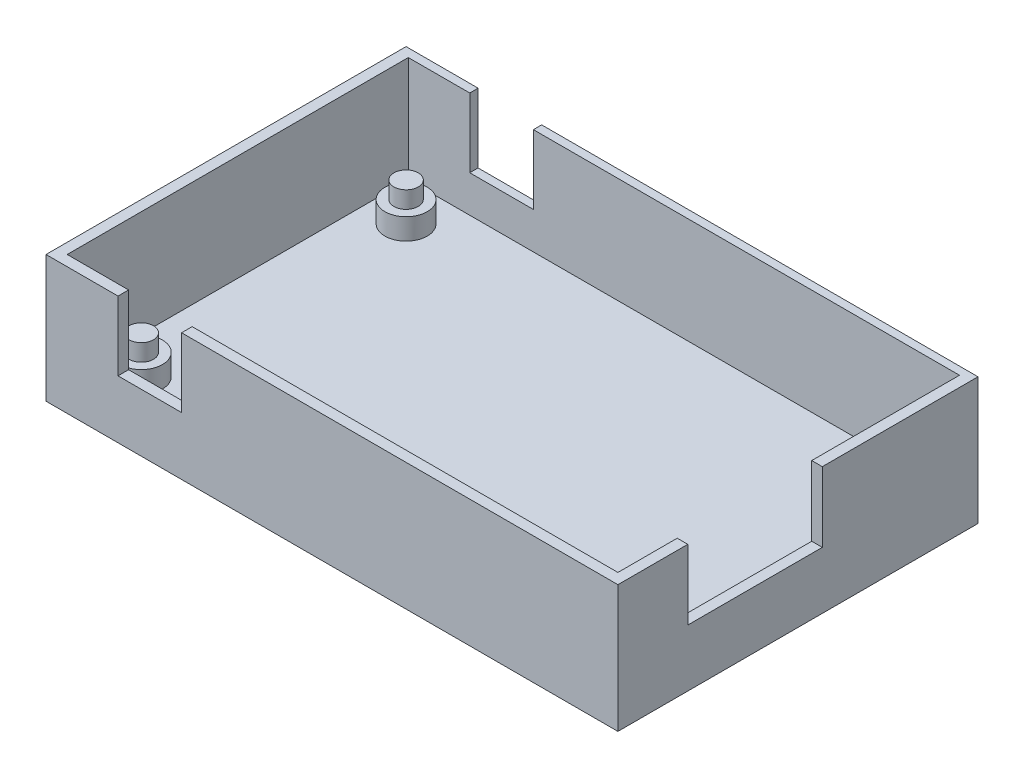
from build123d import *

# Parameters (mm, degrees)
SKETCH1_W           = 68.58
SKETCH1_H           = 43.18
BOSS_EXTRUDE1_DEPTH = 2.54
SKETCH5_R           = 2.54
BOSS_EXTRUDE2_DEPTH = 2.54
SKETCH6_W           = 68.58
SKETCH6_H           = 43.18
BOSS_EXTRUDE3_DEPTH = 12.7
SKETCH7_R           = 1.4605
BOSS_EXTRUDE4_DEPTH = 2.032
SKETCH8_W           = 7.62
SKETCH8_H           = 8.2856324
CUT_EXTRUDE1_DEPTH  = 83.46203005
SKETCH9_W           = 16.129
SKETCH9_H           = 8.382
CUT_EXTRUDE2_DEPTH  = 2.032


with BuildPart() as part:
    # Sketch1 → Boss-Extrude1 (new body)
    with BuildSketch(Plane(origin=(0, 0, 0), x_dir=(1, 0, 0), z_dir=(0, 1, 0))):
        with Locations((34.29, 21.59)):
            Rectangle(SKETCH1_W, SKETCH1_H)
    extrude(amount=BOSS_EXTRUDE1_DEPTH)

    # Sketch5 → Boss-Extrude2 (add)
    with BuildSketch(Plane(origin=(0, 2.54, 0), x_dir=(1, 0, 0), z_dir=(0, 1, 0))):
        with Locations(Location((5.715, 37.465, 0), (0, 0, 90))):
            Circle(SKETCH5_R)
        with Locations(Location((62.865, 37.465, 0), (0, 0, 90))):
            Circle(SKETCH5_R)
        with Locations(Location((5.715, 5.715, 0), (0, 0, 90))):
            Circle(SKETCH5_R)
        with Locations(Location((62.865, 5.715, 0), (0, 0, 90))):
            Circle(SKETCH5_R)
    extrude(amount=BOSS_EXTRUDE2_DEPTH)

    # Sketch6 → Boss-Extrude3 (add)
    with BuildSketch(Plane(origin=(0, 2.54, 0), x_dir=(1, 0, 0), z_dir=(0, 1, 0))):
        with Locations((34.29, 21.59)):
            Rectangle(SKETCH6_W, SKETCH6_H)
        Polygon((1.27, 42.171922196), (1.27, 1.27), (67.31, 1.27), (67.31, 42.229552983), align=None, mode=Mode.SUBTRACT)
    extrude(amount=BOSS_EXTRUDE3_DEPTH)

    # Sketch7 → Boss-Extrude4 (add)
    with BuildSketch(Plane(origin=(0, 5.08, 0), x_dir=(1, 0, 0), z_dir=(0, 1, 0))):
        with Locations(Location((5.715, 37.465, 0), (0, 0, 270))):
            Circle(SKETCH7_R)
        with Locations(Location((5.715, 5.715, 0), (0, 0, 270))):
            Circle(SKETCH7_R)
        with Locations(Location((62.865, 5.715, 0), (0, 0, 270))):
            Circle(SKETCH7_R)
        with Locations(Location((62.865, 37.465, 0), (0, 0, 270))):
            Circle(SKETCH7_R)
    extrude(amount=BOSS_EXTRUDE4_DEPTH)

    # Sketch8 → Cut-Extrude1 (cut, through all)
    with BuildSketch(Plane.XY):
        with Locations((12.446, 11.0971838)):
            Rectangle(SKETCH8_W, SKETCH8_H)
    extrude(amount=-CUT_EXTRUDE1_DEPTH, mode=Mode.SUBTRACT)

    # Sketch9 → Cut-Extrude2 (cut)
    with BuildSketch(Plane(origin=(68.58, 0, 0), x_dir=(0, 0, -1), z_dir=(1, 0, 0))):
        with Locations((16.4465, 11.049)):
            Rectangle(SKETCH9_W, SKETCH9_H)
    extrude(amount=-CUT_EXTRUDE2_DEPTH, mode=Mode.SUBTRACT)


solid = part.part
